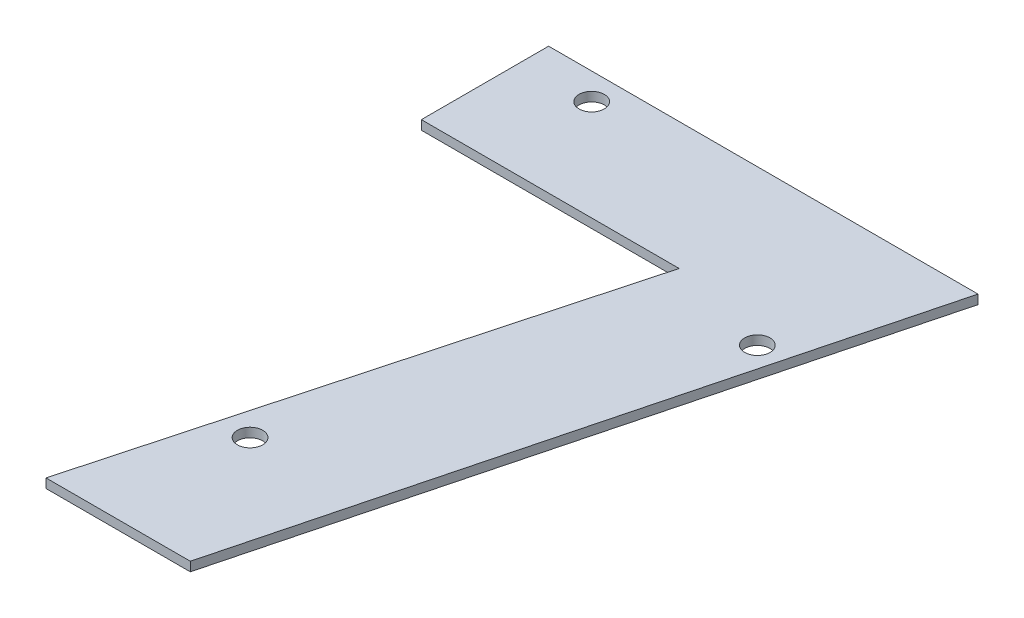
from build123d import *

# Parameters (mm, degrees)
BOSS_EXTRUDE1_DEPTH = 2
SKETCH7_R           = 2.75
CUT_EXTRUDE1_DEPTH  = 104.526033301


with BuildPart() as part:
    # Sketch1 → Boss-Extrude1 (new body)
    with BuildSketch(Plane(origin=(0, 0, 0), x_dir=(1, 0, 0), z_dir=(0, 1, 0))):
        Polygon((-32.806430064, 51.994551896), (60.552740485, 51.994551896), (25.225039266, -83.946442395), (-6.149932227, -83.946442395), (23.249976258, 24.323717363), (-32.806430064, 24.323717363), align=None)
    extrude(amount=BOSS_EXTRUDE1_DEPTH)

    # Sketch7 → Cut-Extrude1 (cut, through all)
    with BuildSketch(Plane(origin=(0, 0, 0), x_dir=(1, 0, 0), z_dir=(0, 1, 0))):
        with Locations(Location((-17.67535185, 46.230759465, 0), (0, 0, 270))):
            Circle(SKETCH7_R)
        with Locations(Location((46.18825301, 18.385111047, 0), (0, 0, 270))):
            Circle(SKETCH7_R)
        with Locations(Location((8.431159892, -54.160966994, 0), (0, 0, 270))):
            Circle(SKETCH7_R)
    extrude(amount=CUT_EXTRUDE1_DEPTH, mode=Mode.SUBTRACT)


solid = part.part
